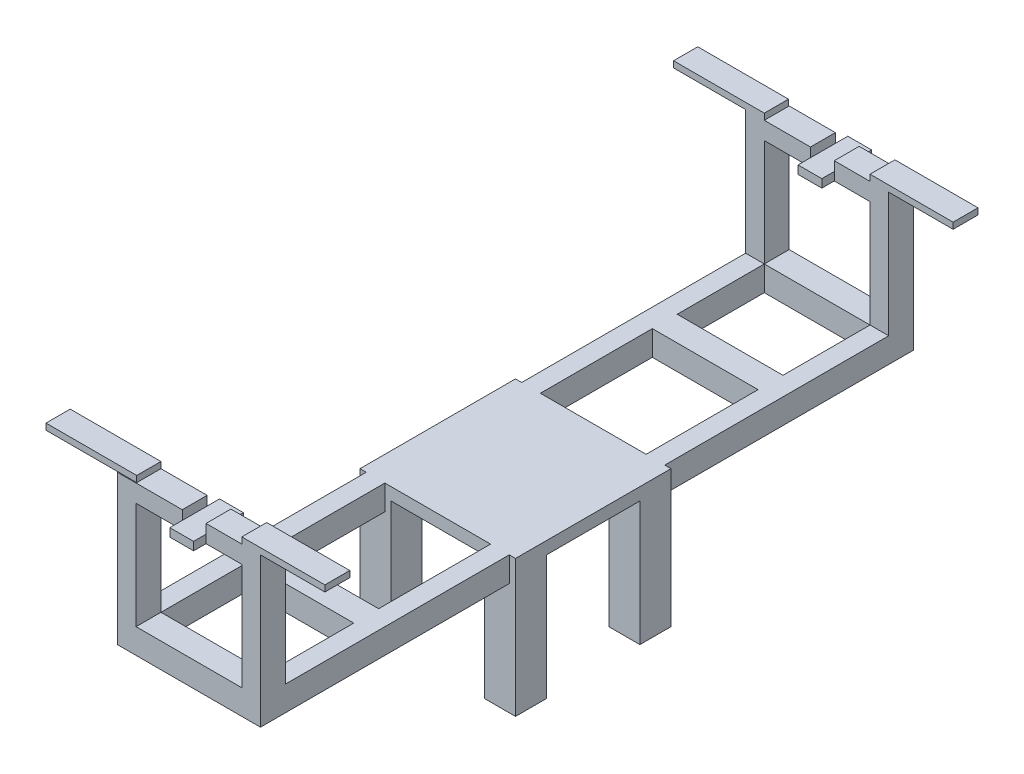
from build123d import *

# Parameters (mm, degrees)
SKETCH_1_W               = 25
SKETCH_1_H               = 25
EXTRUDE_1_DEPTH          = 100
PATTERN_LINEAR_1_COUNT   = 2
PATTERN_LINEAR_1_PITCH   = 100
PATTERN_LINEAR_1_2_COUNT = 2
PATTERN_LINEAR_1_2_PITCH = 100
SKETCH_2_W               = 125
SKETCH_2_H               = 125
EXTRUDE_2_DEPTH          = 10
SKETCH_3_W               = 15
SKETCH_3_H               = 20
EXTRUDE_3_DEPTH          = 200
EXTRUDE_4_REACH          = 349.536
SKETCH_4_W               = 20
SKETCH_4_H               = 20
PATTERN_LINEAR_2_COUNT   = 2
PATTERN_LINEAR_2_PITCH   = 90
SKETCH_5_W               = 15
SKETCH_5_H               = 20
EXTRUDE_5_DEPTH          = 100
EXTRUDE_6_REACH          = 392.872
SKETCH_6_W               = 20
SKETCH_6_H               = 14.103809958
CUT_EXTRUDE_1_REACH      = 389.016
SKETCH_7_W               = 19.107608913
SKETCH_7_H               = 7.486425105
SKETCH_8_W               = 72.938493455
SKETCH_8_H               = 19.454848412
EXTRUDE_7_DEPTH          = 5
SKETCH_9_W               = 66.78878025
SKETCH_9_H               = 20
EXTRUDE_8_DEPTH          = 5
MIRROR_1_COPY_1_REACH    = 349.536
MIRROR_1_COPY_1_SKETCH_W = 20
MIRROR_1_COPY_1_SKETCH_H = 20
EXTRUDE_9_DEPTH          = 10
EXTRUDE_9_DEPTH_BACK     = 30
SKETCH_10_W              = 19.107608913
SKETCH_10_H              = 6.617384853
EXTRUDE_10_DEPTH         = 10
EXTRUDE_10_DEPTH_BACK    = 30
SKETCH_11_W              = 19.107608913
SKETCH_11_H              = 6.617384853


with BuildPart() as part:
    # 草图1 → 凸台-拉伸1 (new body)
    with BuildSketch(Plane(origin=(0, 0, 0), x_dir=(1, 0, 0), z_dir=(0, 1, 0))):
        Rectangle(SKETCH_1_W, SKETCH_1_H)
    extrude(amount=EXTRUDE_1_DEPTH)


with BuildPart() as pattern_linear_1_1:
    # 阵列(线性)1: pattern copy
    add(part.part.moved(Location(Vector(0, 0, 1) * (1 * PATTERN_LINEAR_1_PITCH))))


with BuildPart() as pattern_linear_1_2_1:
    # Pattern Linear 1 2: pattern copy
    add(part.part.moved(Location(Vector(1, 0, 0) * (1 * PATTERN_LINEAR_1_2_PITCH))))


with BuildPart() as pattern_linear_1_2_2:
    # Pattern Linear 1 2: pattern copy
    add(pattern_linear_1_1.part.moved(Location(Vector(1, 0, 0) * (1 * PATTERN_LINEAR_1_2_PITCH))))


with BuildPart() as part_1:
    add(part.part)

    add(pattern_linear_1_1.part)  # 凸台-拉伸2 merges 阵列(线性)1_1

    add(pattern_linear_1_2_1.part)  # 凸台-拉伸2 merges 阵列(线性)1 2_1

    add(pattern_linear_1_2_2.part)  # 凸台-拉伸2 merges 阵列(线性)1 2_2
    # 草图2 → 凸台-拉伸2 (add)
    with BuildSketch(Plane(origin=(0, 100, 0), x_dir=(1, 0, 0), z_dir=(0, 1, 0))):
        with Locations((50, -50)):
            Rectangle(SKETCH_2_W, SKETCH_2_H)
    extrude(amount=EXTRUDE_2_DEPTH)

    # 草图3 → 凸台-拉伸3 (add)
    with BuildSketch(Plane.XY.offset(112.5)):
        with Locations((0, 100)):
            Rectangle(SKETCH_3_W, SKETCH_3_H)
        with Locations((100, 100)):
            Rectangle(SKETCH_3_W, SKETCH_3_H)
    extrude_3 = extrude(amount=EXTRUDE_3_DEPTH)

    # 草图4 → 凸台-拉伸4 (add, up to next)
    with BuildSketch(Plane(origin=(7.5, 0, 0), x_dir=(0, 0, -1), z_dir=(1, 0, 0)), mode=Mode.PRIVATE) as extrude_4_sk1:
        with Locations((-212.5, 100)):
            Rectangle(SKETCH_4_W, SKETCH_4_H)
    extrude_4_tool1 = extrude(extrude_4_sk1.sketch, amount=EXTRUDE_4_REACH, mode=Mode.PRIVATE) - part_1.part
    extrude_4 = extrude_4_tool1.solids().sort_by_distance((7.5, 100, 212.5))[0]
    add(extrude_4)

    # 阵列(线性)2: 凸台-拉伸4 ×2
    with Locations(*[(0, 0, i * PATTERN_LINEAR_2_PITCH) for i in range(1, PATTERN_LINEAR_2_COUNT)]):
        add(extrude_4)

    # 草图5 → 凸台-拉伸5 (add)
    with BuildSketch(Plane(origin=(0, 110, 0), x_dir=(1, 0, 0), z_dir=(0, 1, 0))):
        with Locations((100, -302.5)):
            Rectangle(SKETCH_5_W, SKETCH_5_H)
        with Locations((0, -302.5)):
            Rectangle(SKETCH_5_W, SKETCH_5_H)
    extrude_5 = extrude(amount=EXTRUDE_5_DEPTH)

    # 草图6 → 凸台-拉伸6 (add, up to next)
    with BuildSketch(Plane(origin=(7.5, 0, 0), x_dir=(0, 0, -1), z_dir=(1, 0, 0)), mode=Mode.PRIVATE) as extrude_6_sk1:
        with Locations((-302.5, 202.948095021)):
            Rectangle(SKETCH_6_W, SKETCH_6_H)
    extrude_6_tool1 = extrude(extrude_6_sk1.sketch, amount=EXTRUDE_6_REACH, mode=Mode.PRIVATE) - part_1.part
    extrude_6 = extrude_6_tool1.solids().sort_by_distance((7.5, 202.948095, 302.5))[0]
    add(extrude_6)

    # 草图7 → 切除-拉伸1 (cut, up to next)
    with BuildSketch(Plane(origin=(0, 0, 292.5), x_dir=(-1, 0, 0), z_dir=(0, 0, -1)), mode=Mode.PRIVATE) as cut_extrude_1_sk1:
        with Locations((-54.190265113, 206.256787448)):
            Rectangle(SKETCH_7_W, SKETCH_7_H)
    cut_extrude_1_tool1 = extrude(cut_extrude_1_sk1.sketch, amount=-CUT_EXTRUDE_1_REACH, mode=Mode.PRIVATE) & part_1.part
    cut_extrude_1 = cut_extrude_1_tool1.solids().sort_by_distance((54.190265, 206.256787, 292.5))[0]
    add(cut_extrude_1, mode=Mode.SUBTRACT)

    # 草图8 → 凸台-拉伸7 (add)
    with BuildSketch(Plane(origin=(0, 210, 0), x_dir=(1, 0, 0), z_dir=(0, 1, 0))):
        with Locations((-28.969246727, -302.227424206)):
            Rectangle(SKETCH_8_W, SKETCH_8_H)
    extrude_7 = extrude(amount=EXTRUDE_7_DEPTH)

    # 草图9 → 凸台-拉伸8 (add)
    with BuildSketch(Plane(origin=(0, 210, 0), x_dir=(1, 0, 0), z_dir=(0, 1, 0))):
        with Locations((125.894390125, -302.5)):
            Rectangle(SKETCH_9_W, SKETCH_9_H)
    extrude_8 = extrude(amount=EXTRUDE_8_DEPTH)

    # 镜向1: 凸台-拉伸3, 凸台-拉伸4, 凸台-拉伸5, 凸台-拉伸6, 切除-拉伸1, 凸台-拉伸7, 凸台-拉伸8 across plane
    add(extrude_3.mirror(Plane.XY.offset(50)))
    add(extrude_4.mirror(Plane.XY.offset(50)))
    add(extrude_5.mirror(Plane.XY.offset(50)))
    add(extrude_6.mirror(Plane.XY.offset(50)))
    add(cut_extrude_1.mirror(Plane.XY.offset(50)), mode=Mode.SUBTRACT)
    add(extrude_7.mirror(Plane.XY.offset(50)))
    add(extrude_8.mirror(Plane.XY.offset(50)))

    # 镜向1 copy 1 sketch → 镜向1 copy 1 (add, up to next)
    with BuildSketch(Plane(origin=(7.5, 0, 10), x_dir=(0, 0, 1), z_dir=(1, 0, 0)), mode=Mode.PRIVATE) as mirror_1_copy_1_sk1:
        with Locations((-212.5, -100)):
            Rectangle(MIRROR_1_COPY_1_SKETCH_W, MIRROR_1_COPY_1_SKETCH_H)
    mirror_1_copy_1_tool1 = extrude(mirror_1_copy_1_sk1.sketch, amount=MIRROR_1_COPY_1_REACH, mode=Mode.PRIVATE) - part_1.part
    add(mirror_1_copy_1_tool1.solids().sort_by_distance((7.5, 100, -202.5))[0])

    # 草图10 → 凸台-拉伸9 (add, two sides: drawn at the far end of the back side and taken through both)
    with BuildSketch(Plane.XY.offset(312.5).offset(-EXTRUDE_9_DEPTH_BACK)):
        with Locations((54.190265113, 199.204882468)):
            Rectangle(SKETCH_10_W, SKETCH_10_H)
    extrude(amount=EXTRUDE_9_DEPTH + EXTRUDE_9_DEPTH_BACK)

    # 草图11 → 凸台-拉伸10 (add, two sides: drawn at the far end of the back side and taken through both)
    with BuildSketch(Plane.XY.offset(-192.5).offset(-EXTRUDE_10_DEPTH_BACK)):
        with Locations((54.190265113, 199.204882468)):
            Rectangle(SKETCH_11_W, SKETCH_11_H)
    extrude(amount=EXTRUDE_10_DEPTH + EXTRUDE_10_DEPTH_BACK)


solid = part_1.part
